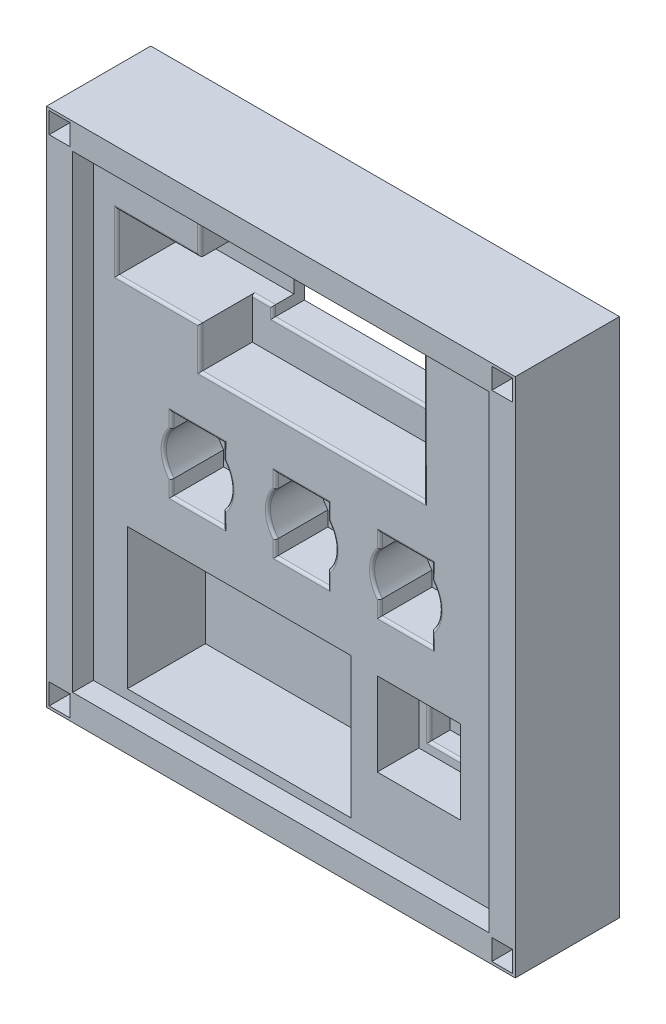
from build123d import *

# Parameters (mm, degrees)
SKETCH2_W           = 90
SKETCH2_H           = 100
BOSS_EXTRUDE1_DEPTH = 50
SKETCH5_W           = 31
SKETCH5_H           = 15
SKETCH5_W_2         = 20
SKETCH5_H_2         = 6
SKETCH5_R           = 3.25
SKETCH5_R_2         = 4.5
CUT_EXTRUDE1_DEPTH  = 50
CUT_EXTRUDE2_DEPTH  = 44
SKETCH5_4_W         = 20
SKETCH5_4_H         = 11
CUT_EXTRUDE3_DEPTH  = 48
SKETCH5_5_R         = 3.25
CUT_EXTRUDE4_DEPTH  = 44
SKETCH5_6_W         = 12
SKETCH5_6_H         = 12
SKETCH5_6_R         = 4.5
CUT_EXTRUDE5_DEPTH  = 46
SKETCH5_7_W         = 16
SKETCH5_7_H         = 16
SKETCH5_7_W_2       = 12
SKETCH5_7_H_2       = 12
CUT_EXTRUDE6_DEPTH  = 42
SKETCH5_10_W        = 33
SKETCH5_10_H        = 27
SKETCH5_10_W_2      = 20
SKETCH5_10_H_2      = 6
CUT_EXTRUDE9_DEPTH  = 49
SKETCH5_11_W        = 80
SKETCH5_11_H        = 90
SKETCH5_11_W_2      = 33
SKETCH5_11_H_2      = 27
SKETCH5_11_W_3      = 16
SKETCH5_11_H_3      = 16
CUT_EXTRUDE10_DEPTH = 34
CUT_EXTRUDE11_DEPTH = 14
FILLET1_R           = 0.5
FILLET2_R           = 0.5
FILLET3_R           = 0.5
FILLET4_R           = 0.5
SKETCH5_12_W        = 90
SKETCH5_12_H        = 100
SKETCH5_12_W_2      = 80
SKETCH5_12_H_2      = 90
CUT_EXTRUDE12_DEPTH = 30
CUT_EXTRUDE13_DEPTH = 5


with BuildPart() as part:
    # Sketch2 → Boss-Extrude1 (new body)
    with BuildSketch(Plane.XY):
        Rectangle(SKETCH2_W, SKETCH2_H)
    extrude(amount=BOSS_EXTRUDE1_DEPTH)

    # Sketch5 → Cut-Extrude1 (cut)
    with BuildSketch(Plane.XY.offset(50)):
        with Locations((0, 30)):
            Rectangle(SKETCH5_W, SKETCH5_H)
        with Locations((-22.5, -25)):
            Rectangle(SKETCH5_W_2, SKETCH5_H_2)
        with Locations((-20, 0)):
            Circle(SKETCH5_R)
        Circle(SKETCH5_R)
        with Locations((20, 0)):
            Circle(SKETCH5_R)
        with Locations((22.5, -25)):
            Circle(SKETCH5_R_2)
    extrude(amount=-CUT_EXTRUDE1_DEPTH, mode=Mode.SUBTRACT)

    # Sketch5<3> → Cut-Extrude2 (cut)
    with BuildSketch(Plane.XY.offset(50)):
        Polygon((-15.5, 35.5), (-15.5, 37.5), (15.5, 37.5), (15.5, 22.5), (-15.5, 22.5), (-15.5, 24.5), (-19.5, 24.5), (-19.5, 16.5), (23.5, 16.5), (23.5, 41.5), (-19.5, 41.5), (-19.5, 35.5), align=None)
    extrude(amount=-CUT_EXTRUDE2_DEPTH, mode=Mode.SUBTRACT)

    # Sketch5<4> → Cut-Extrude3 (cut)
    with BuildSketch(Plane.XY.offset(50)):
        with Locations((-25.5, 30)):
            Rectangle(SKETCH5_4_W, SKETCH5_4_H)
    extrude(amount=-CUT_EXTRUDE3_DEPTH, mode=Mode.SUBTRACT)

    # Sketch5<5> → Cut-Extrude4 (cut)
    # profile 1 of 3: a face of its own
    with BuildSketch(Plane.XY.offset(50)):
        with BuildLine():
            Line((-15, 7), (-25, 7))
            Line((-25, 7), (-25, 4.153311931))
            ThreePointArc((-25, 4.153311931), (-26.5, 0), (-25, -4.153311931))
            Line((-25, -4.153311931), (-25, -7))
            Line((-25, -7), (-15, -7))
            Line((-15, -7), (-15, -4.153311931))
            ThreePointArc((-15, -4.153311931), (-13.5, 0), (-15, 4.153311931))
            Line((-15, 4.153311931), (-15, 7))
        make_face()
        with Locations((-20, 0)):
            Circle(SKETCH5_5_R, mode=Mode.SUBTRACT)
    # profile 2 of 3: a face of its own
    with BuildSketch(Plane.XY.offset(50)):
        with BuildLine():
            Line((5, 7), (-5, 7))
            Line((-5, 7), (-5, 4.153311931))
            ThreePointArc((-5, 4.153311931), (-6.5, 0), (-5, -4.153311931))
            Line((-5, -4.153311931), (-5, -7))
            Line((-5, -7), (5, -7))
            Line((5, -7), (5, -4.153311931))
            ThreePointArc((5, -4.153311931), (6.5, 0), (5, 4.153311931))
            Line((5, 4.153311931), (5, 7))
        make_face()
        Circle(SKETCH5_5_R, mode=Mode.SUBTRACT)
    # profile 3 of 3: a face of its own
    with BuildSketch(Plane.XY.offset(50)):
        with BuildLine():
            Line((25, 7), (15, 7))
            Line((15, 7), (15, 4.153311931))
            ThreePointArc((15, 4.153311931), (13.5, 0), (15, -4.153311931))
            Line((15, -4.153311931), (15, -7))
            Line((15, -7), (25, -7))
            Line((25, -7), (25, -4.153311931))
            ThreePointArc((25, -4.153311931), (26.5, 0), (25, 4.153311931))
            Line((25, 4.153311931), (25, 7))
        make_face()
        with Locations((20, 0)):
            Circle(SKETCH5_5_R, mode=Mode.SUBTRACT)
    extrude(amount=-CUT_EXTRUDE4_DEPTH, mode=Mode.SUBTRACT)

    # Sketch5<6> → Cut-Extrude5 (cut)
    with BuildSketch(Plane.XY.offset(50)):
        with Locations((22.5, -25)):
            Rectangle(SKETCH5_6_W, SKETCH5_6_H)
        with Locations((22.5, -25)):
            Circle(SKETCH5_6_R, mode=Mode.SUBTRACT)
    extrude(amount=-CUT_EXTRUDE5_DEPTH, mode=Mode.SUBTRACT)

    # Sketch5<7> → Cut-Extrude6 (cut)
    with BuildSketch(Plane.XY.offset(50)):
        with Locations((22.5, -25)):
            Rectangle(SKETCH5_7_W, SKETCH5_7_H)
        with Locations((22.5, -25)):
            Rectangle(SKETCH5_7_W_2, SKETCH5_7_H_2, mode=Mode.SUBTRACT)
    extrude(amount=-CUT_EXTRUDE6_DEPTH, mode=Mode.SUBTRACT)

    # Sketch5<10> → Cut-Extrude9 (cut)
    with BuildSketch(Plane.XY.offset(50)):
        with Locations((-17, -29.6470634)):
            Rectangle(SKETCH5_10_W, SKETCH5_10_H)
        with Locations((-22.5, -25)):
            Rectangle(SKETCH5_10_W_2, SKETCH5_10_H_2, mode=Mode.SUBTRACT)
    extrude(amount=-CUT_EXTRUDE9_DEPTH, mode=Mode.SUBTRACT)

    # Sketch5<11> → Cut-Extrude10 (cut)
    with BuildSketch(Plane.XY.offset(50)):
        Rectangle(SKETCH5_11_W, SKETCH5_11_H)
        with Locations((-17, -29.6470634)):
            Rectangle(SKETCH5_11_W_2, SKETCH5_11_H_2, mode=Mode.SUBTRACT)
        with Locations((22.5, -25)):
            Rectangle(SKETCH5_11_W_3, SKETCH5_11_H_3, mode=Mode.SUBTRACT)
        with BuildLine():
            Line((-25, 4.153311931), (-25, 7))
            Line((-25, 7), (-15, 7))
            Line((-15, 7), (-15, 4.153311931))
            ThreePointArc((-15, 4.153311931), (-13.88649037, 2.207940217), (-13.5, 0))
            ThreePointArc((-13.5, 0), (-13.88649037, -2.207940217), (-15, -4.153311931))
            Line((-15, -4.153311931), (-15, -7))
            Line((-15, -7), (-25, -7))
            Line((-25, -7), (-25, -4.153311931))
            ThreePointArc((-25, -4.153311931), (-26.5, 0), (-25, 4.153311931))
        make_face(mode=Mode.SUBTRACT)
        Polygon((-35.5, 35.5), (-19.5, 35.5), (-19.5, 41.5), (23.5, 41.5), (23.5, 16.5), (-19.5, 16.5), (-19.5, 24.5), (-35.5, 24.5), align=None, mode=Mode.SUBTRACT)
        with BuildLine():
            Line((-5, 4.153311931), (-5, 7))
            Line((-5, 7), (5, 7))
            Line((5, 7), (5, 4.153311931))
            ThreePointArc((5, 4.153311931), (6.11350963, 2.207940217), (6.5, 0))
            ThreePointArc((6.5, 0), (6.11350963, -2.207940217), (5, -4.153311931))
            Line((5, -4.153311931), (5, -7))
            Line((5, -7), (-5, -7))
            Line((-5, -7), (-5, -4.153311931))
            ThreePointArc((-5, -4.153311931), (-6.5, 0), (-5, 4.153311931))
        make_face(mode=Mode.SUBTRACT)
        with BuildLine():
            Line((15, 4.153311931), (15, 7))
            Line((15, 7), (25, 7))
            Line((25, 7), (25, 4.153311931))
            ThreePointArc((25, 4.153311931), (26.11350963, 2.207940217), (26.5, 0))
            ThreePointArc((26.5, 0), (26.11350963, -2.207940217), (25, -4.153311931))
            Line((25, -4.153311931), (25, -7))
            Line((25, -7), (15, -7))
            Line((15, -7), (15, -4.153311931))
            ThreePointArc((15, -4.153311931), (13.5, 0), (15, 4.153311931))
        make_face(mode=Mode.SUBTRACT)
    extrude(amount=-CUT_EXTRUDE10_DEPTH, mode=Mode.SUBTRACT)

    # Sketch6 → Cut-Extrude11 (cut)
    with BuildSketch(Plane.XY.offset(16)):
        Polygon((-0.5, -16.1470634), (4.5, -16.1470634), (9.5, -16.1470634), (9.5, -43.1470634), (-0.5, -43.1470634), align=None)
    extrude(amount=-CUT_EXTRUDE11_DEPTH, mode=Mode.SUBTRACT)

    # Fillet1
    fillet1_edges = [part.edges().sort_by_distance(p)[0] for p in [
        (-17.5, 24.5, 6),
        (-15.5, 23.5, 6),
        (0, 22.5, 6),
        (15.5, 30, 6),
        (0, 37.5, 6),
        (-17.5, 35.5, 6),
        (-15.5, 36.5, 6),
    ]]
    fillet(fillet1_edges, radius=FILLET1_R)

    # Fillet2
    fillet2_edges = [part.edges().sort_by_distance(p)[0] for p in [
        (13.5, 0, 16),
        (15, -5.576655966, 16),
        (20, -7, 16),
        (25, -5.576655966, 16),
        (26.5, 0, 16),
        (25, 5.576655966, 16),
        (20, 7, 16),
        (15, 5.576655966, 16),
        (5, -5.576655966, 16),
        (6.5, 0, 16),
        (5, 5.576655966, 16),
        (0, 7, 16),
        (0, -7, 16),
        (-5, -5.576655966, 16),
        (-5, 5.576655966, 16),
        (-6.5, 0, 16),
        (-26.5, 0, 16),
        (-25, -5.576655966, 16),
        (-20, -7, 16),
        (-15, -5.576655966, 16),
        (-13.5, 0, 16),
        (-15, 5.576655966, 16),
        (-20, 7, 16),
        (-25, 5.576655966, 16),
    ]]
    fillet(fillet2_edges, radius=FILLET2_R)

    # Fillet3
    fillet3_edges = [part.edges().sort_by_distance(p)[0] for p in [
        (22.5, -31, 8),
        (16.5, -25, 8),
        (22.5, -19, 8),
        (28.5, -25, 8),
    ]]
    fillet(fillet3_edges, radius=FILLET3_R)

    # Fillet4
    fillet4_edges = [part.edges().sort_by_distance(p)[0] for p in [
        (-27.5, 24.5, 16),
        (-35.5, 30, 16),
        (-27.5, 35.5, 16),
        (-19.5, 38.5, 16),
        (-19.5, 20.5, 16),
        (2, 16.5, 16),
        (23.5, 29, 16),
        (2, 41.5, 16),
    ]]
    fillet(fillet4_edges, radius=FILLET4_R)

    # Sketch5<12> → Cut-Extrude12 (cut)
    with BuildSketch(Plane.XY.offset(50)):
        Rectangle(SKETCH5_12_W, SKETCH5_12_H)
        Rectangle(SKETCH5_12_W_2, SKETCH5_12_H_2, mode=Mode.SUBTRACT)
    extrude(amount=-CUT_EXTRUDE12_DEPTH, mode=Mode.SUBTRACT)

    # Sketch8 → Cut-Extrude13 (cut)
    with BuildSketch(Plane.XY.offset(20)):
        Polygon((-40.5, 49.5), (-42.5, 49.5), (-44.5, 49.5), (-44.5, 45.5), (-40.5, 45.5), align=None)
        Polygon((-40.5, -45.5), (-42.5, -45.5), (-44.5, -45.5), (-44.5, -49.5), (-40.5, -49.5), align=None)
        Polygon((42.5, -45.5), (40.5, -45.5), (40.5, -49.5), (44.5, -49.5), (44.5, -45.5), align=None)
        Polygon((42.5, 49.5), (40.5, 49.5), (40.5, 45.5), (44.5, 45.5), (44.5, 49.5), align=None)
    extrude(amount=-CUT_EXTRUDE13_DEPTH, mode=Mode.SUBTRACT)


solid = part.part
